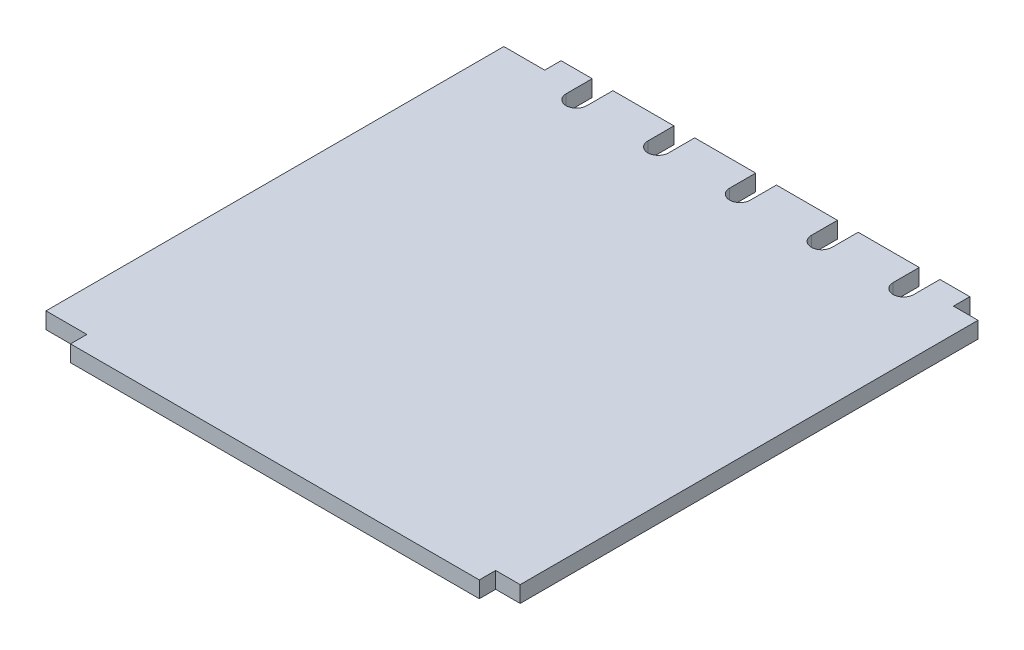
from build123d import *

# Parameters (mm, degrees)
BOSS_EXTRUDE1_DEPTH = 5.08


with BuildPart() as part:
    # Sketch1 → Boss-Extrude1 (new body)
    with BuildSketch(Plane(origin=(0, 0, 0), x_dir=(1, 0, 0), z_dir=(0, 1, 0))):
        with BuildLine():
            Line((-71.12, 71.12), (-63.5, 71.12))
            Line((-63.5, 71.12), (-63.5, 76.2))
            Line((-63.5, 76.2), (-53.821964394, 76.2))
            Line((-53.821964394, 76.2), (-53.821964394, 68.090455215))
            ThreePointArc((-53.821964394, 68.090455215), (-50.602147322, 64.870638143), (-47.38233025, 68.090455215))
            Line((-47.38233025, 68.090455215), (-47.38233025, 76.2))
            Line((-47.38233025, 76.2), (-28.421964394, 76.2))
            Line((-28.421964394, 76.2), (-28.421964394, 68.090455215))
            ThreePointArc((-28.421964394, 68.090455215), (-25.202147322, 64.870638143), (-21.98233025, 68.090455215))
            Line((-21.98233025, 68.090455215), (-21.98233025, 76.2))
            Line((-21.98233025, 76.2), (-3.021964394, 76.2))
            Line((-3.021964394, 76.2), (-3.021964394, 68.090455215))
            ThreePointArc((-3.021964394, 68.090455215), (0.197852678, 64.870638143), (3.41766975, 68.090455215))
            Line((3.41766975, 68.090455215), (3.41766975, 76.2))
            Line((3.41766975, 76.2), (22.378035606, 76.2))
            Line((22.378035606, 76.2), (22.378035606, 68.090455215))
            ThreePointArc((22.378035606, 68.090455215), (25.597852678, 64.870638143), (28.81766975, 68.090455215))
            Line((28.81766975, 68.090455215), (28.81766975, 76.2))
            Line((28.81766975, 76.2), (47.778035606, 76.2))
            Line((47.778035606, 76.2), (47.778035606, 68.090455215))
            ThreePointArc((47.778035606, 68.090455215), (50.997852678, 64.870638143), (54.21766975, 68.090455215))
            Line((54.21766975, 68.090455215), (54.21766975, 76.2))
            Line((54.21766975, 76.2), (63.5, 76.2))
            Line((63.5, 76.2), (63.5, 71.12))
            Line((63.5, 71.12), (71.12, 71.12))
            Line((71.12, 71.12), (71.12, 63.5))
            Line((71.12, 63.5), (71.12, -63.5))
            Line((71.12, -63.5), (71.12, -71.12))
            Line((71.12, -71.12), (63.5, -71.12))
            Line((63.5, -71.12), (63.5, -76.2))
            Line((63.5, -76.2), (-63.5, -76.2))
            Line((-63.5, -76.2), (-63.5, -71.12))
            Line((-63.5, -71.12), (-71.12, -71.12))
            Line((-71.12, -71.12), (-76.2, -71.12))
            Line((-76.2, -71.12), (-76.2, -63.5))
            Line((-76.2, -63.5), (-76.2, 63.5))
            Line((-76.2, 63.5), (-76.2, 71.12))
            Line((-76.2, 71.12), (-71.12, 71.12))
        make_face()
    extrude(amount=BOSS_EXTRUDE1_DEPTH)


solid = part.part
